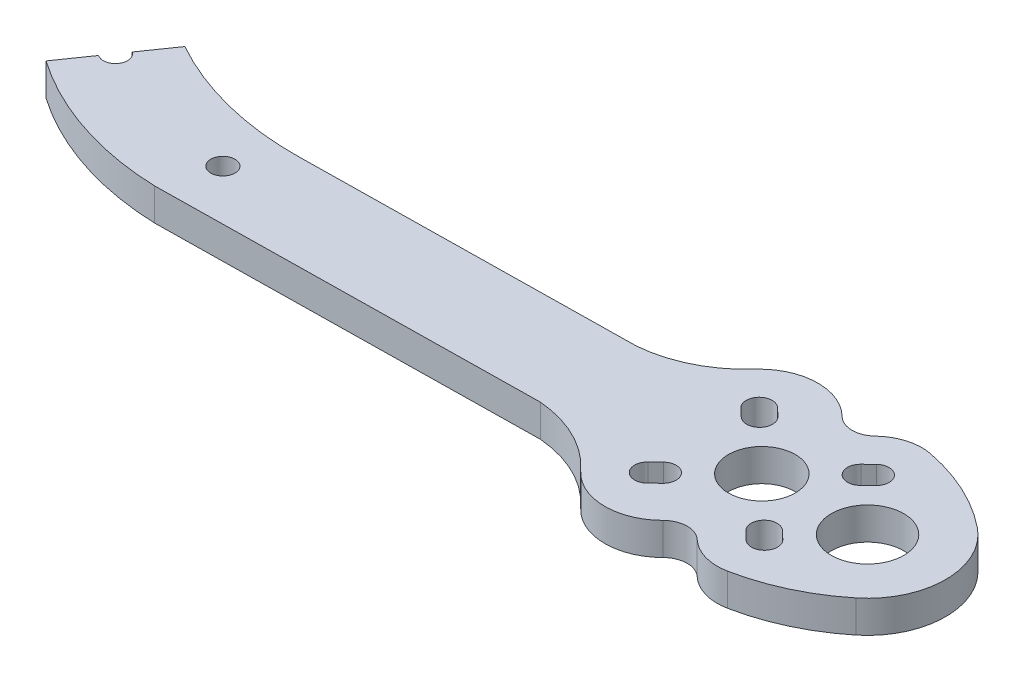
from build123d import *

# Parameters (mm, degrees)
SKETCH1_R           = 4.5
SKETCH1_R_2         = 4.15
SKETCH1_R_3         = 1.5
BOSS_EXTRUDE2_DEPTH = 4


with BuildPart() as part:
    # Sketch1 → Boss-Extrude2 (new body)
    with BuildSketch(Plane(origin=(0, 0, 0), x_dir=(1, 0, 0), z_dir=(0, 1, 0))):
        with BuildLine():
            Line((24.492030041, 32), (-16.82364897, 31.38929644))
            ThreePointArc((-16.82364897, 31.38929644), (-26.628373919, 32.520273369), (-35.798432863, 36.170171872))
            Line((-35.798432863, 36.170171872), (-38.479754021, 32.316380416))
            ThreePointArc((-38.479754021, 32.316380416), (-38.105147294, 30.228398184), (-40.193129525, 29.853791457))
            Line((-40.193129525, 29.853791457), (-42.874450683, 26))
            ThreePointArc((-42.874450683, 26), (-33.263093393, 21.189213431), (-22.681899906, 19.302363998))
            Line((-22.681899906, 19.302363998), (24.519122197, 20.000061166))
            ThreePointArc((24.519122197, 20.000061166), (29.912542793, 18.512398384), (34.38564897, 15.151825901))
            ThreePointArc((34.38564897, 15.151825901), (39.572200335, 12.78648108), (44.865586737, 14.901955396))
            ThreePointArc((44.865586737, 14.901955396), (46.941127439, 15.77786367), (49.041095181, 14.962253472))
            ThreePointArc((49.041095181, 14.962253472), (51.498094019, 13.563547988), (54.322847672, 13.445280812))
            ThreePointArc((54.322847672, 13.445280812), (60.067220976, 15.331144894), (65.190877045, 18.540888881))
            ThreePointArc((65.190877045, 18.540888881), (68.785066518, 26.1), (65.156781581, 33.642805002))
            ThreePointArc((65.156781581, 33.642805002), (60.018684596, 36.829381119), (54.265854499, 38.689288065))
            ThreePointArc((54.265854499, 38.689288065), (51.441663661, 38.558267317), (48.991005527, 37.148481859))
            ThreePointArc((48.991005527, 37.148481859), (46.894741967, 36.323397867), (44.815267383, 37.189925399))
            ThreePointArc((44.815267383, 37.189925399), (39.512382816, 39.281476607), (34.336564706, 36.892736755))
            ThreePointArc((34.336564706, 36.892736755), (29.878678322, 33.512000849), (24.492030041, 32))
        make_face()
        with Locations(Location((59.085066518, 26.078100395, 0), (0, 0, 270))):
            Circle(SKETCH1_R, mode=Mode.SUBTRACT)
        with Locations(Location((45.985066518, 26.04852464, 0), (0, 0, 270))):
            Circle(SKETCH1_R_2, mode=Mode.SUBTRACT)
        with Locations(Location((-20.570161775, 25.66516132, 0), (0, 0, 270))):
            Circle(SKETCH1_R_3, mode=Mode.SUBTRACT)
        with BuildLine():
            Line((39.841844345, 34.144341712), (40.83090249, 33.199674393))
            ThreePointArc((40.83090249, 33.199674393), (40.883202658, 30.92140707), (38.604935336, 30.869106902))
            Line((38.604935336, 30.869106902), (37.615877191, 31.813774221))
            ThreePointArc((37.615877191, 31.813774221), (37.563577023, 34.092041544), (39.841844345, 34.144341712))
        make_face(mode=Mode.SUBTRACT)
        with BuildLine():
            Line((52.091670541, 34.171998037), (51.106887992, 33.222874395))
            ThreePointArc((51.106887992, 33.222874395), (51.064875553, 30.944394144), (53.343355804, 30.902381704))
            Line((53.343355804, 30.902381704), (54.328138354, 31.851505346))
            ThreePointArc((54.328138354, 31.851505346), (54.370150793, 34.129985598), (52.091670541, 34.171998037))
        make_face(mode=Mode.SUBTRACT)
        with BuildLine():
            Line((52.128288691, 17.952707568), (51.139230546, 18.897374887))
            ThreePointArc((51.139230546, 18.897374887), (51.086930378, 21.17564221), (53.365197701, 21.227942378))
            Line((53.365197701, 21.227942378), (54.354255846, 20.283275059))
            ThreePointArc((54.354255846, 20.283275059), (54.406556014, 18.005007736), (52.128288691, 17.952707568))
        make_face(mode=Mode.SUBTRACT)
        with BuildLine():
            Line((39.878462495, 17.925051243), (40.863245045, 18.874174885))
            ThreePointArc((40.863245045, 18.874174885), (40.905257484, 21.152655136), (38.626777232, 21.194667576))
            Line((38.626777232, 21.194667576), (37.641994683, 20.245543933))
            ThreePointArc((37.641994683, 20.245543933), (37.599982244, 17.967063682), (39.878462495, 17.925051243))
        make_face(mode=Mode.SUBTRACT)
    extrude(amount=BOSS_EXTRUDE2_DEPTH)


solid = part.part
